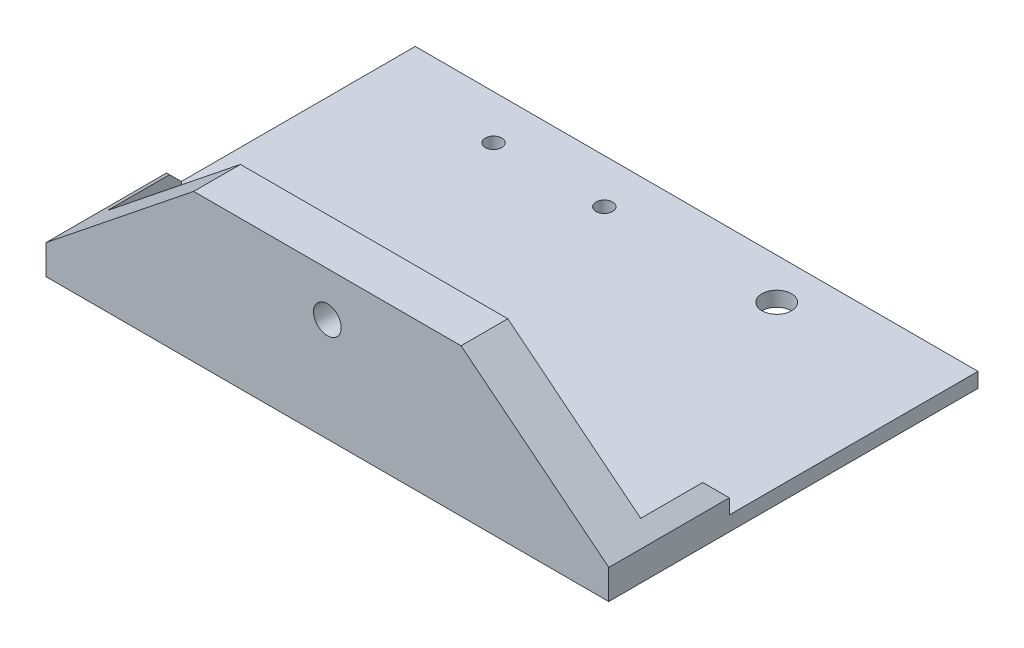
from build123d import *

# Parameters (mm, degrees)
BOSS_EXTRUDE1_DEPTH      = 2.54
BOSS_EXTRUDE1_DEPTH_BACK = 2.54
SKETCH1_W                = 69.85
SKETCH1_H                = 63.5
SKETCH1_R                = 1.4224
SKETCH1_R_2              = 2.54
SKETCH2_W                = 69.85
SKETCH2_H                = 8.038671265
BOSS_EXTRUDE2_DEPTH      = 20.32
BOSS_EXTRUDE3_DEPTH      = 2.54
BOSS_EXTRUDE4_DEPTH      = 2.54
SKETCH5_W                = 42.761328735
SKETCH5_H                = 2.54
CUT_EXTRUDE1_DEPTH       = 89.142435188
SKETCH6_W                = 69.85
SKETCH6_H                = 2.54
BOSS_EXTRUDE5_DEPTH      = 12.7
SKETCH7_W                = 69.85
SKETCH7_H                = 2.54
CUT_EXTRUDE2_DEPTH       = 12.7
SKETCH8_R                = 2.38125
CUT_EXTRUDE3_DEPTH       = 96.449847624
BOSS_EXTRUDE6_DEPTH      = 10.922
BOSS_EXTRUDE7_DEPTH      = 10.922
CUT_EXTRUDE4_DEPTH       = 10.922
CUT_EXTRUDE5_DEPTH       = 10.922
CUT_EXTRUDE6_DEPTH       = 104.461914585
CUT_EXTRUDE6_DEPTH_BACK  = 104.461914585


with BuildPart() as part:
    # Sketch1 → Boss-Extrude1 (new, two sides: drawn at the far end of the back side and taken through both)
    with BuildSketch(Plane(origin=(0, 0, 0), x_dir=(1, 0, 0), z_dir=(0, 1, 0)).offset(-BOSS_EXTRUDE1_DEPTH_BACK)):
        with Locations((30.031991128, 8.648073975)):
            Rectangle(SKETCH1_W, SKETCH1_H)
        with Locations(Location((2.726991128, 32.778073975, 0), (0, 0, 270))):
            Circle(SKETCH1_R, mode=Mode.SUBTRACT)
        with Locations(Location((21.776991128, 32.778073975, 0), (0, 0, 270))):
            Circle(SKETCH1_R, mode=Mode.SUBTRACT)
        with Locations(Location((2.726991128, 1.028073975, 0), (0, 0, 270))):
            Circle(SKETCH1_R, mode=Mode.SUBTRACT)
        with Locations(Location((21.776991128, 1.028073975, 0), (0, 0, 270))):
            Circle(SKETCH1_R, mode=Mode.SUBTRACT)
        with Locations(Location((49.680840227, -9.802293314, 0), (0, 0, 270))):
            Circle(SKETCH1_R_2, mode=Mode.SUBTRACT)
        with Locations(Location((50.825492869, 33.377706686, 0), (0, 0, 270))):
            Circle(SKETCH1_R_2, mode=Mode.SUBTRACT)
    extrude(amount=BOSS_EXTRUDE1_DEPTH + BOSS_EXTRUDE1_DEPTH_BACK)

    # Sketch2 → Boss-Extrude2 (add)
    with BuildSketch(Plane(origin=(0, 2.54, 0), x_dir=(1, 0, 0), z_dir=(0, 1, 0))):
        with Locations((30.031991128, -19.082590393)):
            Rectangle(SKETCH2_W, SKETCH2_H)
    extrude(amount=BOSS_EXTRUDE2_DEPTH)

    # Sketch3 → Boss-Extrude3 (add)
    with BuildSketch(Plane.ZY.offset(4.893008872)):
        Polygon((15.06325476, 15.24), (2.36325476, 2.54), (-40.398073975, 2.54), (-40.398073975, -2.54), (23.101926025, -2.54), (23.101926025, 22.86), (15.06325476, 22.86), align=None)
    extrude(amount=BOSS_EXTRUDE3_DEPTH)

    # Sketch4 → Boss-Extrude4 (add)
    with BuildSketch(Plane(origin=(64.956991128, 0, 0), x_dir=(0, 0, -1), z_dir=(1, 0, 0))):
        Polygon((-15.06325476, 15.24), (-2.36325476, 2.54), (40.398073975, 2.54), (40.398073975, -2.54), (-23.101926025, -2.54), (-23.101926025, 22.86), (-15.06325476, 22.86), align=None)
    extrude(amount=BOSS_EXTRUDE4_DEPTH)

    # Sketch5 → Cut-Extrude1 (cut, through all)
    with BuildSketch(Plane.ZY.offset(7.433008872)):
        with Locations((-19.017409607, 1.27)):
            Rectangle(SKETCH5_W, SKETCH5_H)
    extrude(amount=-CUT_EXTRUDE1_DEPTH, mode=Mode.SUBTRACT)

    # Sketch6 → Boss-Extrude5 (add)
    with BuildSketch(Plane(origin=(0, 0, 2.36325476), x_dir=(-1, 0, 0), z_dir=(0, 0, -1))):
        with Locations((-30.031991128, 1.27)):
            Rectangle(SKETCH6_W, SKETCH6_H)
    extrude(amount=-BOSS_EXTRUDE5_DEPTH)

    # Sketch7 → Cut-Extrude2 (cut)
    with BuildSketch(Plane(origin=(0, 0, 2.36325476), x_dir=(-1, 0, 0), z_dir=(0, 0, -1))):
        with Locations((-30.031991128, 1.27)):
            Rectangle(SKETCH7_W, SKETCH7_H)
    extrude(amount=-CUT_EXTRUDE2_DEPTH, mode=Mode.SUBTRACT)

    # Sketch8 → Cut-Extrude3 (cut, through all)
    with BuildSketch(Plane.XY.offset(23.101926025)):
        with Locations((30.031991128, 15.24)):
            Circle(SKETCH8_R)
    extrude(amount=-CUT_EXTRUDE3_DEPTH, mode=Mode.SUBTRACT)

    # Sketch9 → Boss-Extrude6 (add)
    with BuildSketch(Plane(origin=(67.496991128, 0, 0), x_dir=(0, 0, -1), z_dir=(1, 0, 0))):
        Polygon((-2.36325476, 0), (-2.36325476, 2.54), (-15.06325476, 15.24), (-15.06325476, 22.86), (-23.101926025, 22.86), (-23.101926025, -2.54), (40.398073975, -2.54), (40.398073975, 0), align=None)
    extrude(amount=BOSS_EXTRUDE6_DEPTH)

    # Sketch10 → Boss-Extrude7 (add)
    with BuildSketch(Plane.ZY.offset(7.433008872)):
        Polygon((2.36325476, 2.54), (2.36325476, 0), (-40.398073975, 0), (-40.398073975, -2.54), (23.101926025, -2.54), (23.101926025, 22.86), (15.06325476, 22.86), (15.06325476, 15.24), align=None)
    extrude(amount=BOSS_EXTRUDE7_DEPTH)

    # Sketch12 → Cut-Extrude4 (cut)
    with BuildSketch(Plane.ZY.offset(-64.956991128)):
        Polygon((15.06325476, 15.24), (2.36325476, 2.54), (2.36325476, 0), (15.06325476, 0), align=None)
    extrude(amount=-CUT_EXTRUDE4_DEPTH, mode=Mode.SUBTRACT)

    # Sketch13 → Cut-Extrude5 (cut)
    with BuildSketch(Plane(origin=(-4.893008872, 0, 0), x_dir=(0, 0, -1), z_dir=(1, 0, 0))):
        Polygon((-2.36325476, 2.54), (-15.06325476, 15.24), (-15.06325476, 0), (-2.36325476, 0), align=None)
    extrude(amount=-CUT_EXTRUDE5_DEPTH, mode=Mode.SUBTRACT)

    # Sketch14 → Cut-Extrude6 (cut, two sides: drawn at the far end of the back side and taken through both)
    with BuildSketch(Plane.XY.offset(23.101926025).offset(-CUT_EXTRUDE6_DEPTH_BACK)):
        Polygon((78.418991128, 22.86), (53.018991128, 22.86), (78.418991128, 2.54), align=None)
        Polygon((-18.355008872, 22.86), (7.044991128, 22.86), (-18.355008872, 2.54), align=None)
    extrude(amount=CUT_EXTRUDE6_DEPTH + CUT_EXTRUDE6_DEPTH_BACK, mode=Mode.SUBTRACT)


solid = part.part
